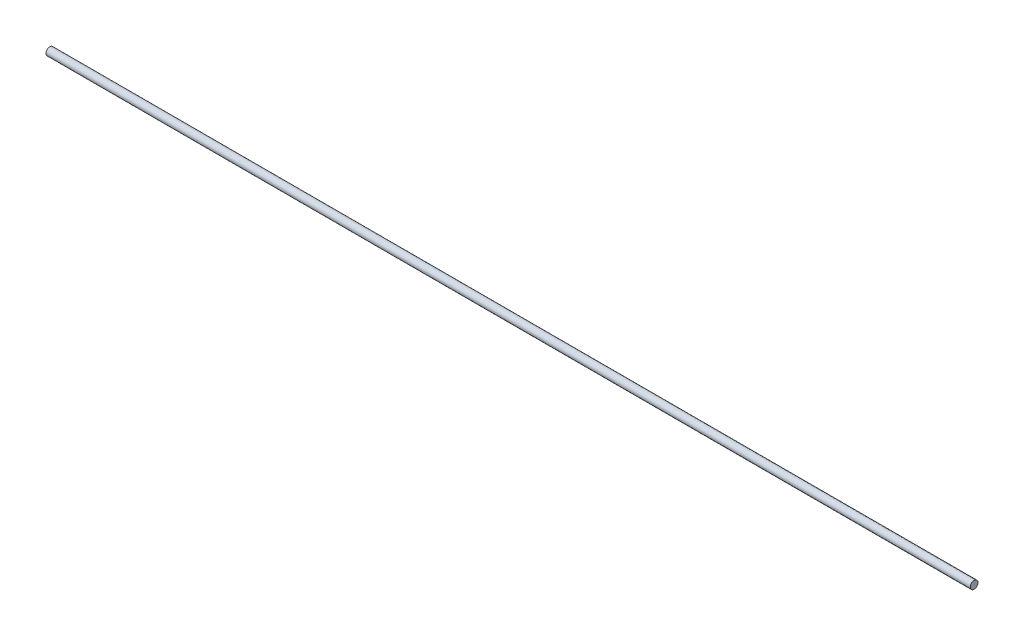
from build123d import *

# Parameters (mm, degrees)
SKETCH1_R           = 6.35
BOSS_EXTRUDE1_DEPTH = 1524


with BuildPart() as part:
    # Sketch1 → Boss-Extrude1 (new body)
    with BuildSketch(Plane(origin=(0, 0, 0), x_dir=(0, 0, -1), z_dir=(1, 0, 0))):
        Circle(SKETCH1_R)
    extrude(amount=BOSS_EXTRUDE1_DEPTH)


solid = part.part
